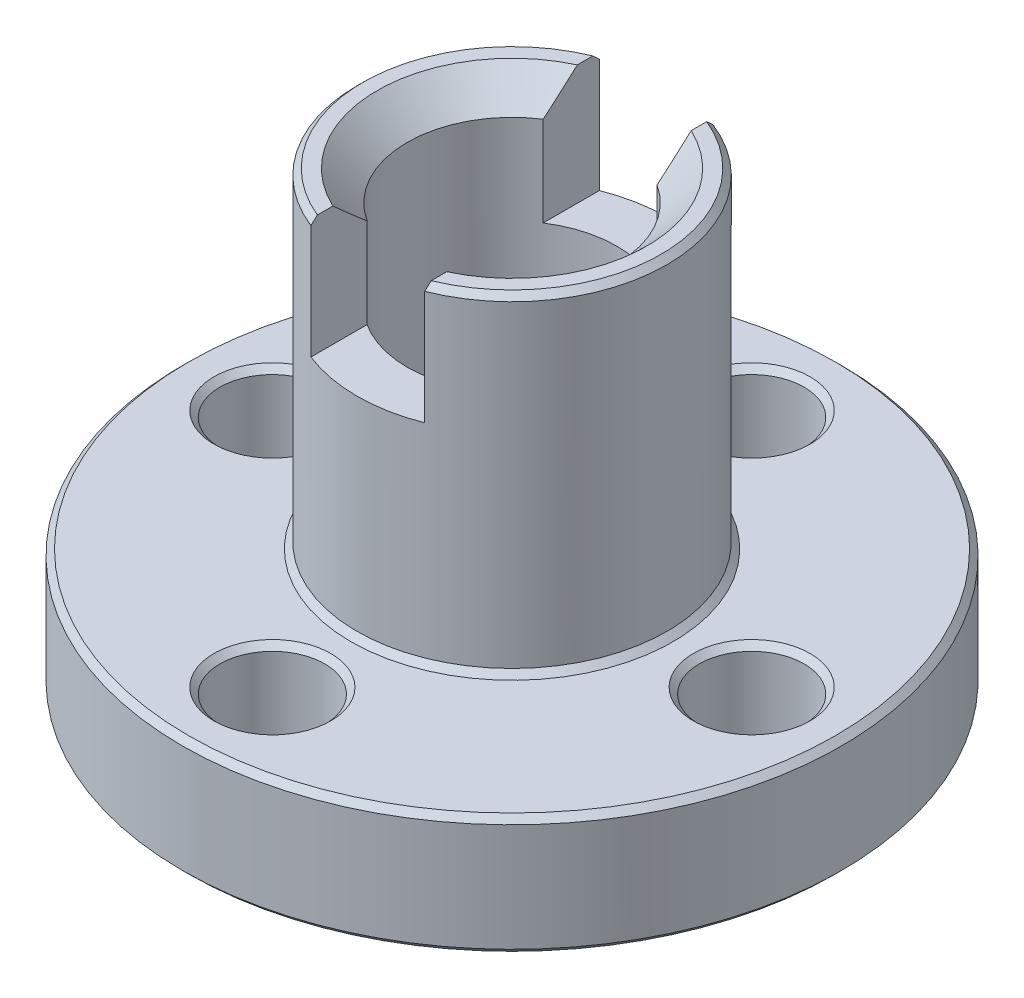
from build123d import *

# Parameters (mm, degrees)
CUT_EXTRUDE_1_DEPTH      = 22.610182785
CUT_EXTRUDE_1_DEPTH_BACK = 22.610182785
SKETCH_3_W               = 3.8
SKETCH_3_H               = 4
SKETCH_4_R               = 1.75
CUT_EXTRUDE_2_DEPTH      = 4
CHAMFER_1_SIZE           = 1
CHAMFER_2_SIZE           = 0.2


with BuildPart() as part:
    # Эскиз2 → Повернуть1 (revolve)
    with BuildSketch(Plane(origin=(0, 0, 0), x_dir=(0, 0, -1), z_dir=(1, 0, 0)), mode=Mode.PRIVATE) as revolve_1_sk:
        Polygon((3.5, 15), (3.5, 0), (11, 0), (11, 4), (5.175, 4), (5.175, 15), align=None)
    revolve(revolve_1_sk.sketch.rotate(Axis((0, 40.815789474, 0), (0, -1, 0)), 180), axis=Axis((0, 40.815789474, 0), (0, -1, 0)))

    # Эскиз3 → Вырез-Вытянуть1 (cut, two sides: drawn at the far end of the back side and taken through both)
    with BuildSketch(Plane.XY.offset(-CUT_EXTRUDE_1_DEPTH_BACK)):
        with Locations((0, 13)):
            Rectangle(SKETCH_3_W, SKETCH_3_H)
    extrude(amount=CUT_EXTRUDE_1_DEPTH + CUT_EXTRUDE_1_DEPTH_BACK, mode=Mode.SUBTRACT)

    # Эскиз4 → Вырез-Вытянуть2 (cut)
    with BuildSketch(Plane.XZ):
        with Locations(Location((0, 8, 0), (0, 0, 270))):
            Circle(SKETCH_4_R)
        with Locations(Location((8, 0, 0), (0, 0, 270))):
            Circle(SKETCH_4_R)
        with Locations(Location((0, -8, 0), (0, 0, 270))):
            Circle(SKETCH_4_R)
        with Locations(Location((-8, 0, 0), (0, 0, 270))):
            Circle(SKETCH_4_R)
    extrude(amount=-CUT_EXTRUDE_2_DEPTH, mode=Mode.SUBTRACT)

    # Фаска1
    chamfer_1_edges = [part.edges().sort_by_distance(p)[0] for p in [
        (-3.5, 15, 0),
        (0, 0, -3.5),
        (3.5, 15, 0),
    ]]
    chamfer(chamfer_1_edges, length=CHAMFER_1_SIZE)

    # Фаска2
    chamfer_2_edges = [part.edges().sort_by_distance(p)[0] for p in [
        (-5.175, 15, 0),
        (0, 4, 9.75),
        (0, 0, 9.75),
        (8, 4, 1.75),
        (8, 0, 1.75),
        (5.175, 15, 0),
        (0, 4, -6.25),
        (0, 0, -6.25),
        (0, 4, -5.175),
        (-8, 4, 1.75),
        (-8, 0, 1.75),
        (0, 4, -11),
        (0, 0, -11),
    ]]
    chamfer(chamfer_2_edges, length=CHAMFER_2_SIZE)


solid = part.part
